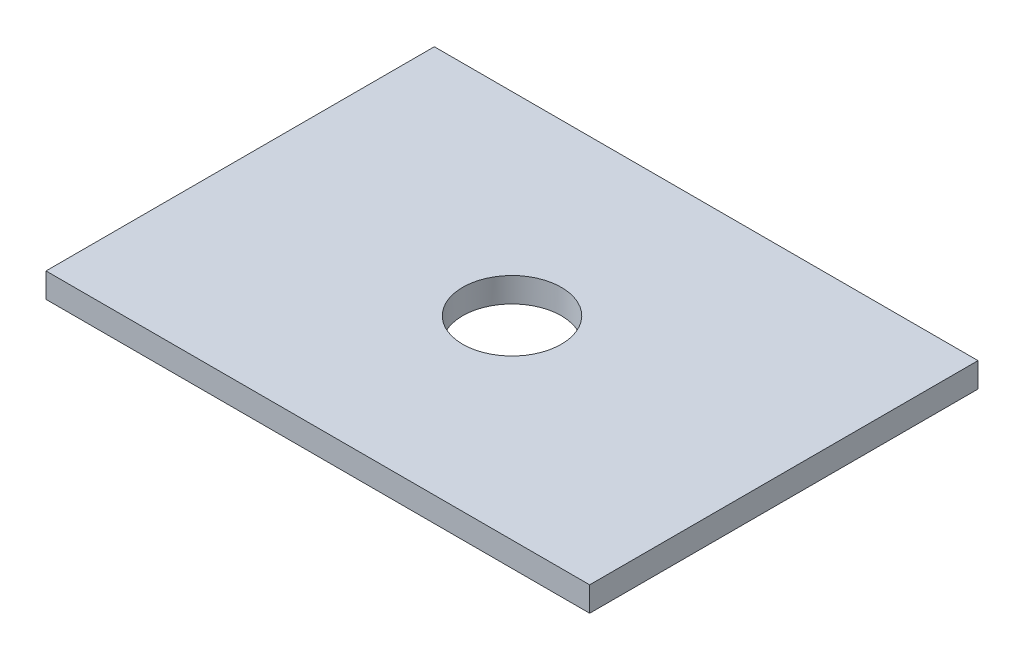
from build123d import *

# Parameters (mm, degrees)
SKETCH1_W           = 140
SKETCH1_H           = 100
BOSS_EXTRUDE1_DEPTH = 6.35
SKETCH2_R           = 12.705
CUT_EXTRUDE1_DEPTH  = 10


with BuildPart() as part:
    # Sketch1 → Boss-Extrude1 (new body)
    with BuildSketch(Plane(origin=(0, 0, 0), x_dir=(1, 0, 0), z_dir=(0, 1, 0))):
        with Locations((70, 50)):
            Rectangle(SKETCH1_W, SKETCH1_H)
    extrude(amount=BOSS_EXTRUDE1_DEPTH)

    # Sketch2 → Cut-Extrude1 (cut)
    with BuildSketch(Plane(origin=(0, 6.35, 0), x_dir=(1, 0, 0), z_dir=(0, 1, 0))):
        with Locations(Location((70, 50, 0), (0, 0, 270))):
            Circle(SKETCH2_R)
    extrude(amount=-CUT_EXTRUDE1_DEPTH, mode=Mode.SUBTRACT)


solid = part.part
